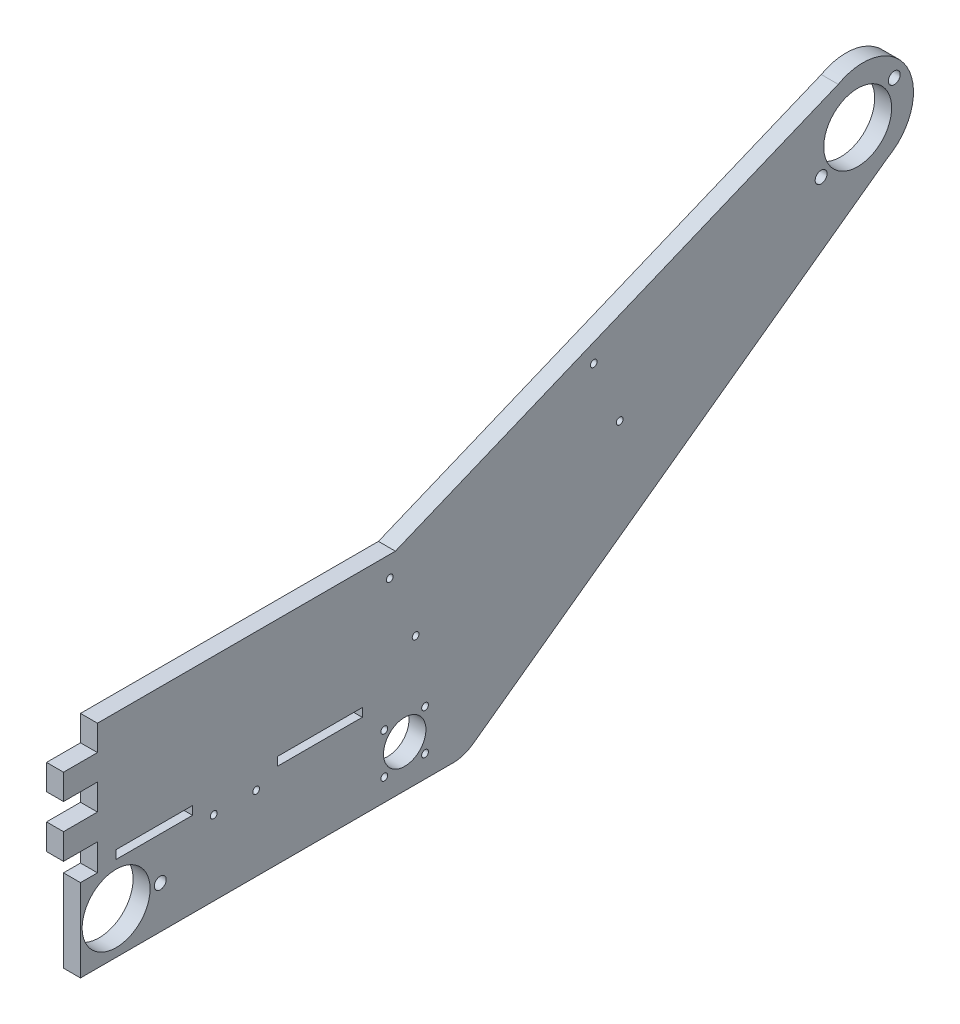
from build123d import *

# Parameters (mm, degrees)
EXTRUDE_2_DEPTH      = 10
SKETCH_3_R           = 3.5
SKETCH_3_R_2         = 20
SKETCH_3_R_3         = 2
SKETCH_3_R_4         = 12.5
CUT_EXTRUDE_1_DEPTH  = 660.636515889
SKETCH_6_W           = 10
SKETCH_6_H           = 50
CUT_EXTRUDE_14_DEPTH = 5
SKETCH_7_W           = 45
SKETCH_7_H           = 5
SKETCH_7_W_2         = 50
CUT_EXTRUDE_17_DEPTH = 660.636515889
SKETCH_4_R           = 2
CUT_EXTRUDE_18_DEPTH = 10
SKETCH_8_W           = 10
SKETCH_8_H           = 55
EXTRUDE_3_DEPTH      = 10
SKETCH_9_R           = 3.5
SKETCH_9_R_2         = 20
CUT_EXTRUDE_19_DEPTH = 660.636515889
EXTRUDE_4_DEPTH      = 10
SKETCH_14_R          = 20
SKETCH_14_R_2        = 3
CUT_EXTRUDE_20_DEPTH = 660.636515889
SKETCH_15_R          = 2
CUT_EXTRUDE_22_DEPTH = 660.636515889
CUT_EXTRUDE_26_DEPTH = 660.636515889


with BuildPart() as part:
    # 스케치1 → 보스-돌출2 (new body)
    with BuildSketch(Plane(origin=(0, 0, 0), x_dir=(0, 0, -1), z_dir=(1, 0, 0))):
        with BuildLine():
            Line((-350, -25), (353.480885827, -25))
            ThreePointArc((353.480885827, -25), (359.679041929, -24.015332259), (365.266885594, -21.158286093))
            Line((365.266885594, -21.158286093), (609.458437468, 155.703306991))
            ThreePointArc((609.458437468, 155.703306991), (620.947494037, 196.239910069), (580.410890959, 207.728966637))
            Line((580.410890959, 207.728966637), (150, 30))
            Line((150, 30), (-350, 30))
            Line((-350, 30), (-350, -25))
        make_face()
    extrude(amount=EXTRUDE_2_DEPTH)

    # 스케치3 → 컷-돌출1 (cut, through all)
    with BuildSketch(Plane(origin=(10, 0, 0), x_dir=(0, 0, -1), z_dir=(1, 0, 0))):
        with Locations((613.415951219, 194.53901549)):
            Circle(SKETCH_3_R)
        with Locations((570.305997446, 165.46098451)):
            Circle(SKETCH_3_R)
        with Locations((591.860974332, 180)):
            Circle(SKETCH_3_R_2)
        with Locations((337, -12)):
            Circle(SKETCH_3_R_3)
        with Locations((313, 12)):
            Circle(SKETCH_3_R_3)
        with Locations((313, -12)):
            Circle(SKETCH_3_R_3)
        with Locations((337, 12)):
            Circle(SKETCH_3_R_3)
        with Locations((325, 0)):
            Circle(SKETCH_3_R_4)
        with Locations((-313, -12)):
            Circle(SKETCH_3_R_3)
        with Locations((-313, 12)):
            Circle(SKETCH_3_R_3)
        with Locations((-325, 0)):
            Circle(SKETCH_3_R_4)
        with Locations((-337, -12)):
            Circle(SKETCH_3_R_3)
        with Locations((-337, 12)):
            Circle(SKETCH_3_R_3)
    extrude(amount=-CUT_EXTRUDE_1_DEPTH, mode=Mode.SUBTRACT)

    # 스케치6 → 컷-돌출14 (cut)
    with BuildSketch(Plane(origin=(0, 30, 0), x_dir=(1, 0, 0), z_dir=(0, 1, 0))):
        with Locations((5, -75)):
            Rectangle(SKETCH_6_W, SKETCH_6_H)
        with Locations((5, -275)):
            Rectangle(SKETCH_6_W, SKETCH_6_H)
        with Locations((5, 75)):
            Rectangle(SKETCH_6_W, SKETCH_6_H)
        with Locations((5, -175)):
            Rectangle(SKETCH_6_W, SKETCH_6_H)
    extrude(amount=-CUT_EXTRUDE_14_DEPTH, mode=Mode.SUBTRACT)

    # 스케치7 → 컷-돌출17 (cut, through all)
    with BuildSketch(Plane(origin=(10, 0, 0), x_dir=(0, 0, -1), z_dir=(1, 0, 0))):
        with Locations((177.5, 27.5)):
            Rectangle(SKETCH_7_W, SKETCH_7_H)
        with Locations((275, 27.5)):
            Rectangle(SKETCH_7_W_2, SKETCH_7_H)
    extrude(amount=-CUT_EXTRUDE_17_DEPTH, mode=Mode.SUBTRACT)

    # 스케치4 → 컷-돌출18 (cut)
    with BuildSketch(Plane(origin=(10, 0, 0), x_dir=(0, 0, -1), z_dir=(1, 0, 0))):
        with Locations((-237.5, 19)):
            Circle(SKETCH_4_R)
        with Locations(Location((-212.5, 19, 0), (0, 0, 180))):
            Circle(SKETCH_4_R)
        with Locations((-139.996213119, 19)):
            Circle(SKETCH_4_R)
        with Locations(Location((-114.996213119, 19, 0), (0, 0, 180))):
            Circle(SKETCH_4_R)
        with Locations((112.5, 19)):
            Circle(SKETCH_4_R)
        with Locations((212.5, 19)):
            Circle(SKETCH_4_R)
        with Locations(Location((237.5, 19, 0), (0, 0, 180))):
            Circle(SKETCH_4_R)
    extrude(amount=-CUT_EXTRUDE_18_DEPTH, mode=Mode.SUBTRACT)

    # 스케치8 → 보스-돌출3 (add)
    with BuildSketch(Plane.XY.offset(350)):
        with Locations((5, 2.5)):
            Rectangle(SKETCH_8_W, SKETCH_8_H)
    extrude(amount=EXTRUDE_3_DEPTH)

    # 스케치9 → 컷-돌출19 (cut, through all)
    with BuildSketch(Plane(origin=(10, 0, 0), x_dir=(0, 0, -1), z_dir=(1, 0, 0))):
        with Locations((-92.5, 0)):
            Circle(SKETCH_9_R)
        with Locations(Location((-40.5, 0, 0), (0, 0, 180))):
            Circle(SKETCH_9_R)
        with Locations(Location((-66.5, 0, 0), (0, 0, 180))):
            Circle(SKETCH_9_R_2)
        with Locations((155, 0)):
            Circle(SKETCH_9_R_2)
        with Locations((181, 0)):
            Circle(SKETCH_9_R)
        with Locations(Location((129, 0, 0), (0, 0, 180))):
            Circle(SKETCH_9_R)
    extrude(amount=-CUT_EXTRUDE_19_DEPTH, mode=Mode.SUBTRACT)

    # 스케치10 → 보스-돌출4 (add)
    with BuildSketch(Plane(origin=(0, 0, 0), x_dir=(0, 0, -1), z_dir=(1, 0, 0))):
        Polygon((100, 30), (100, 25), (50, 25), (50, 30), (-50, 30), (-360, 30), (-360, 100), (-50, 100), (319.520832407, 100), (150, 30), align=None)
    extrude(amount=EXTRUDE_4_DEPTH)

    # 스케치14 → 컷-돌출20 (cut, through all)
    with BuildSketch(Plane(origin=(10, 0, 0), x_dir=(0, 0, -1), z_dir=(1, 0, 0))):
        with Locations((44.25, 11)):
            Circle(SKETCH_14_R)
        with Locations((70.25, 11)):
            Circle(SKETCH_14_R_2)
        with Locations(Location((18.25, 11, 0), (0, 0, 180))):
            Circle(SKETCH_14_R_2)
    extrude(amount=-CUT_EXTRUDE_20_DEPTH, mode=Mode.SUBTRACT)

    # 스케치15 → 컷-돌출22 (cut, through all)
    with BuildSketch(Plane(origin=(10, 0, 0), x_dir=(0, 0, -1), z_dir=(1, 0, 0))):
        with Locations((331.433412373, 50.824001827)):
            Circle(SKETCH_15_R)
        with Locations((316.195018887, 87.807665301)):
            Circle(SKETCH_15_R)
        with Locations(Location((451.630318664, 100.348780655, 0), (0, 0, 180))):
            Circle(SKETCH_15_R)
        with Locations(Location((436.391925178, 137.332444129, 0), (0, 0, 180))):
            Circle(SKETCH_15_R)
    extrude(amount=-CUT_EXTRUDE_22_DEPTH, mode=Mode.SUBTRACT)

    # 스케치17 → 컷-돌출26 (cut, through all)
    with BuildSketch(Plane(origin=(10, 0, 0), x_dir=(0, 0, -1), z_dir=(1, 0, 0))):
        Polygon((134, 100), (144, 100), (144, 85), (124, 85), (124, 70.009449614), (144, 70.009449614), (144, 54.646019177), (124, 54.646019177), (124, 39.485590498), (144, 39.485590498), (144, 23.660735911), (134, 23.660735911), (134, -25.259204994), (-374.726859986, -25.259204994), (-374.726859986, 260.6847899), (134, 260.6847899), align=None)
    extrude(amount=-CUT_EXTRUDE_26_DEPTH, mode=Mode.SUBTRACT)


solid = part.part
